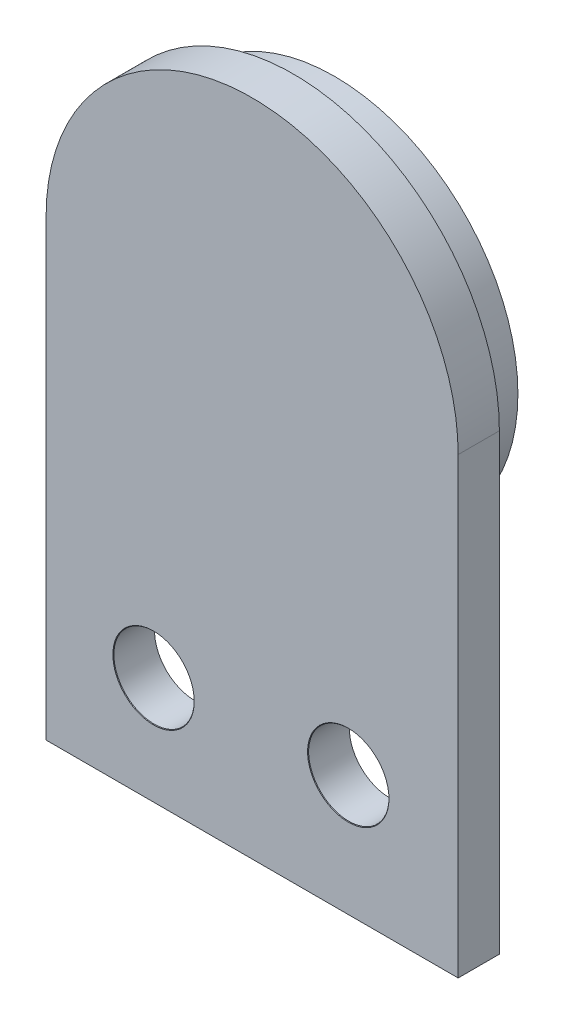
from build123d import *

# Parameters (mm, degrees)
BOSS_EXTRUDE1_DEPTH              = 2
SKETCH2_R                        = 8.9
BOSS_EXTRUDE2_DEPTH              = 2
SKETCH3_R                        = 2
BOSS_EXTRUDE3_DEPTH              = 3
M3_5_CLEARANCE_HOLE1_D           = 3.9
M3_5_CLEARANCE_HOLE1_CSINK_D     = 3.95
M3_5_CLEARANCE_HOLE1_CSINK_ANGLE = 90


with BuildPart() as part:
    # Sketch1 → Boss-Extrude1 (new body)
    with BuildSketch(Plane.XY):
        with BuildLine():
            Line((-10, 0), (-10, -22))
            Line((-10, -22), (10, -22))
            Line((10, -22), (10, 0))
            ThreePointArc((10, 0), (0, 10), (-10, 0))
        make_face()
    extrude(amount=BOSS_EXTRUDE1_DEPTH)

    # Sketch2 → Boss-Extrude2 (add)
    with BuildSketch(Plane(origin=(0, 0, 0), x_dir=(-1, 0, 0), z_dir=(0, 0, -1))):
        Circle(SKETCH2_R)
    extrude(amount=BOSS_EXTRUDE2_DEPTH)

    # Sketch3 → Boss-Extrude3 (add)
    with BuildSketch(Plane(origin=(0, 0, -2), x_dir=(-1, 0, 0), z_dir=(0, 0, -1))):
        Circle(SKETCH3_R)
    extrude(amount=BOSS_EXTRUDE3_DEPTH)

    # M3.5 Clearance Hole1 (through all)
    with Locations(Plane.XY.offset(2)):
        with Locations((-4.784779524, -16.781056018), (4.667291899, -16.141017378)):
            CounterSinkHole(M3_5_CLEARANCE_HOLE1_D / 2, M3_5_CLEARANCE_HOLE1_CSINK_D / 2, counter_sink_angle=M3_5_CLEARANCE_HOLE1_CSINK_ANGLE)


solid = part.part
